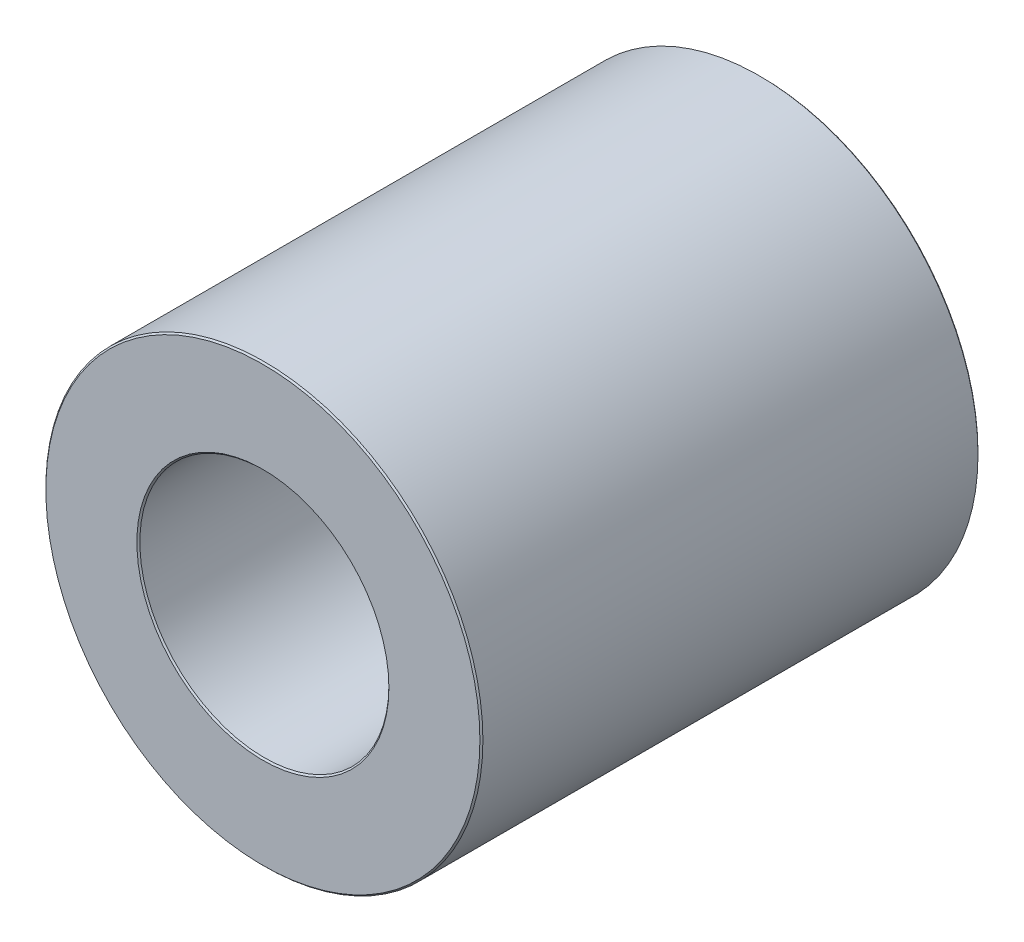
from build123d import *

# Parameters (mm, degrees)
BOSS_EXTRUDE1_DEPTH      = 4
BOSS_EXTRUDE1_DEPTH_BACK = 4
SKETCH5_R                = 3.51
SKETCH5_R_2              = 2
CHAMFER1_SIZE            = 0.024


with BuildPart() as part:
    # Sketch5 → Boss-Extrude1 (new, two sides: drawn at the far end of the back side and taken through both)
    with BuildSketch(Plane.XY.offset(-BOSS_EXTRUDE1_DEPTH_BACK)):
        Circle(SKETCH5_R)
        Circle(SKETCH5_R_2, mode=Mode.SUBTRACT)
    extrude(amount=BOSS_EXTRUDE1_DEPTH + BOSS_EXTRUDE1_DEPTH_BACK)

    # Chamfer1
    chamfer1_edges = [part.edges().sort_by_distance(p)[0] for p in [
        (-3.51, 0, 4),
        (-2, 0, 4),
        (-3.51, 0, -4),
        (-2, 0, -4),
    ]]
    chamfer(chamfer1_edges, length=CHAMFER1_SIZE)


solid = part.part
